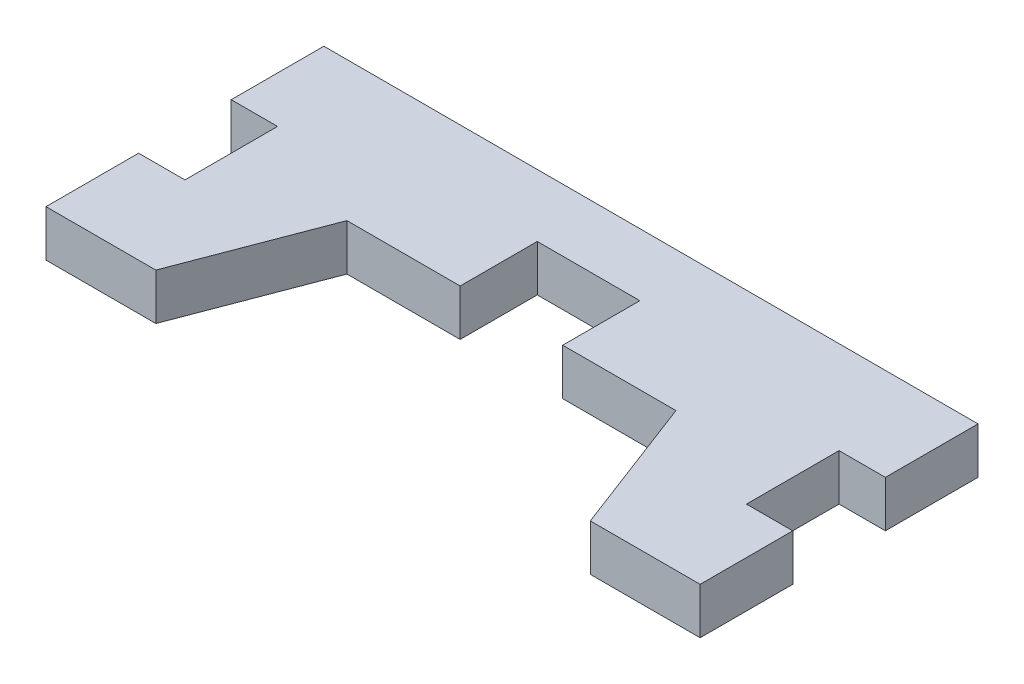
from build123d import *

# Parameters (mm, degrees)
BOSS_EXTRUDE1_DEPTH = 6


with BuildPart() as part:
    # Sketch1 → Boss-Extrude1 (new body)
    with BuildSketch(Plane(origin=(0, 0, 0), x_dir=(1, 0, 0), z_dir=(0, 1, 0))):
        Polygon((18.70861147, -16.803768911), (4.478237082, -16.803768911), (4.478237082, -4.803768911), (10.478237082, -4.803768911), (10.478237082, 7.196231089), (4.478237082, 7.196231089), (4.478237082, 19.196231089), (89.225400432, 19.196231089), (89.225400432, 7.196231089), (83.225400432, 7.196231089), (83.225400432, -4.803768911), (89.225400432, -4.803768911), (89.225400432, -16.803768911), (74.995026045, -16.803768911), (68.164741017, 1.122998621), (53.496778433, 1.122998621), (53.496778433, 11.113606856), (40.206859082, 11.113606856), (40.206859082, 1.122998621), (25.538896498, 1.122998621), align=None)
    extrude(amount=BOSS_EXTRUDE1_DEPTH)


solid = part.part
